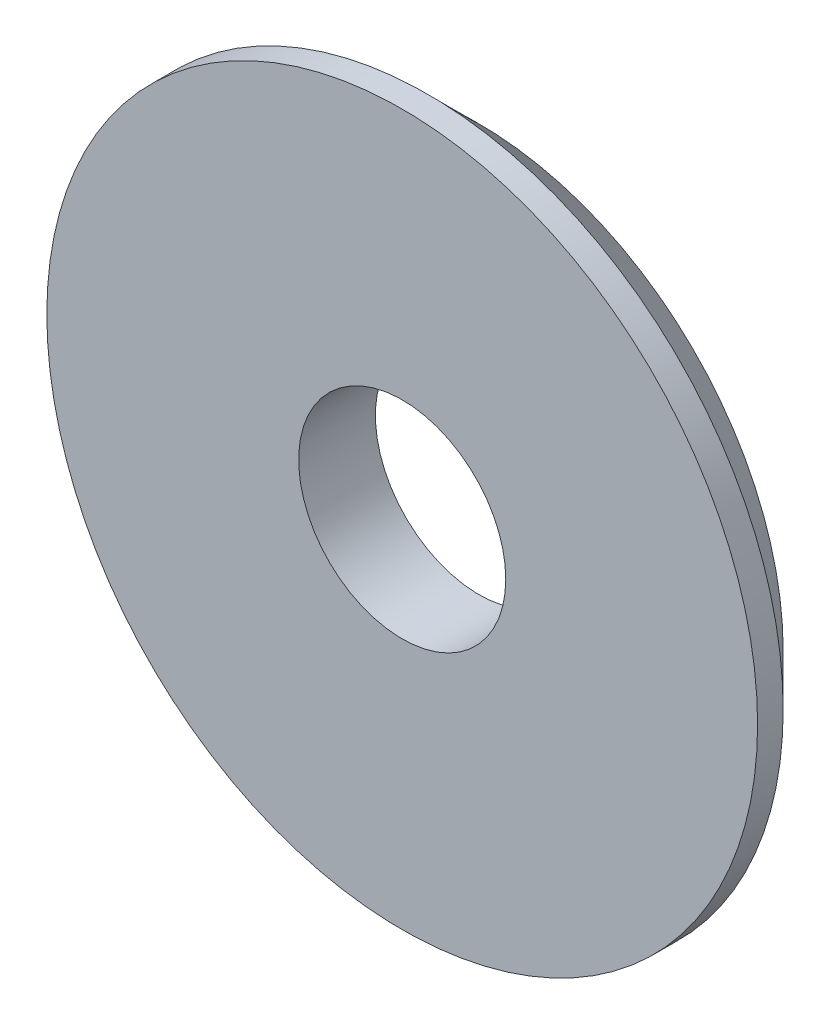
from build123d import *

# Parameters (mm, degrees)
SKETCH_1_R      = 13.9
SKETCH_1_R_2    = 4.05
EXTRUDE_1_DEPTH = 3
CHAMFER_1_SIZE  = 2


with BuildPart() as part:
    # 草图1 → 凸台-拉伸1 (new body)
    with BuildSketch(Plane.XY):
        Circle(SKETCH_1_R)
        Circle(SKETCH_1_R_2, mode=Mode.SUBTRACT)
    extrude(amount=EXTRUDE_1_DEPTH)

    # 倒角1
    chamfer_1_edges = [part.edges().sort_by_distance(p)[0] for p in [
        (-13.9, 0, 0),
    ]]
    chamfer(chamfer_1_edges, length=CHAMFER_1_SIZE)


solid = part.part
